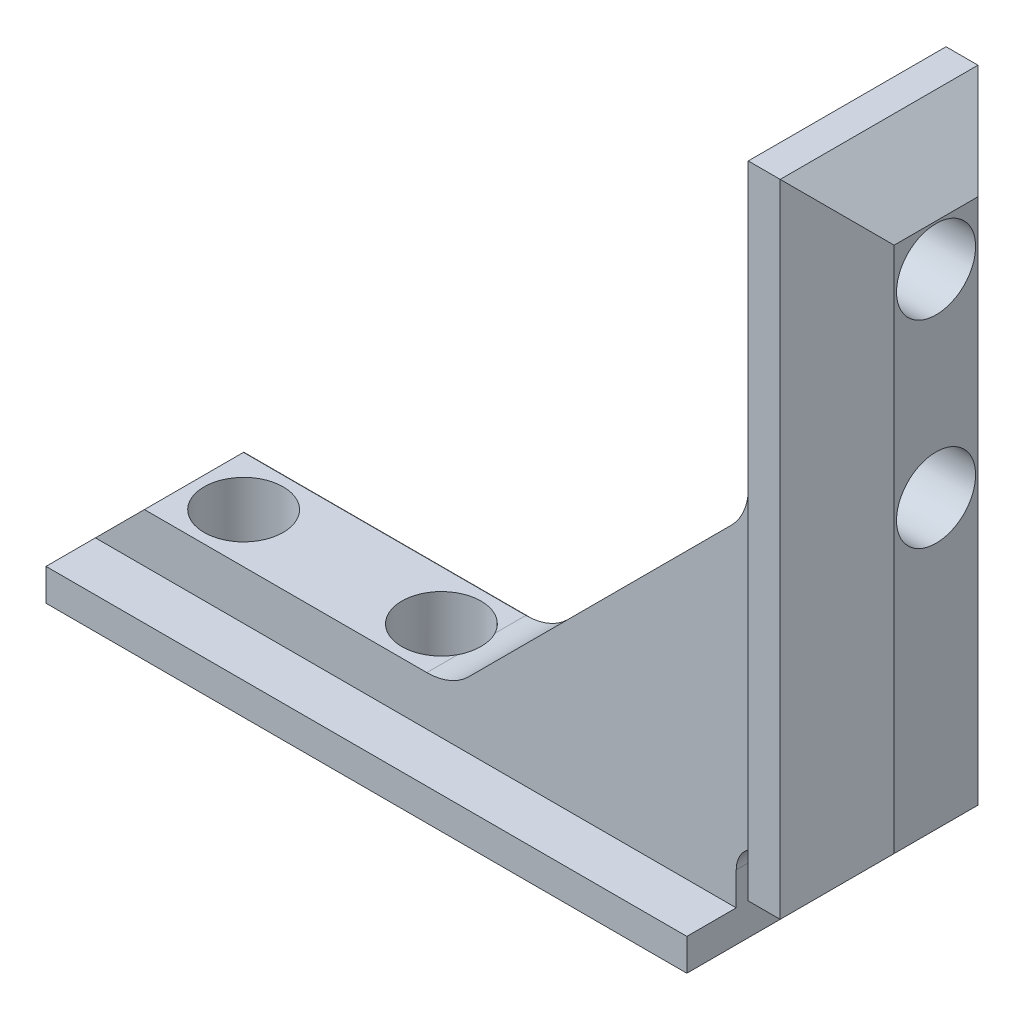
from build123d import *

# Parameters (mm, degrees)
EXTRUDE1_DEPTH          = 15.875
SKETCH2_W               = 56.3626
SKETCH2_H               = 56.3626
CUT_EXTRUDE1_DEPTH      = 3.9624
SKETCH3_W               = 56.3626
SKETCH3_H               = 56.3626
CUT_EXTRUDE2_DEPTH      = 3.9624
CUT_EXTRUDE3_DEPTH      = 174.221342401
CUT_EXTRUDE4_DEPTH      = 138.612224622
SKETCH7_R               = 3.175
CUT_EXTRUDE6_DEPTH      = 174.221342401
CUT_EXTRUDE7_DEPTH      = 3.9624
CUT_EXTRUDE7_DEPTH_BACK = 133.865789145
SKETCH9_R               = 3.175


with BuildPart() as part:
    # Sketch1 → Extrude1 (new body)
    with BuildSketch(Plane.XY):
        with BuildLine():
            Line((108.579689187, 130.408922074), (87.518897096, 109.348129983))
            ThreePointArc((87.518897096, 109.348129983), (85.973830897, 108.315749755), (84.15130105, 107.953226029))
            Line((84.15130105, 107.953226029), (61.485993141, 107.953226029))
            Line((61.485993141, 107.953226029), (57.548993141, 104.016226029))
            Line((57.548993141, 104.016226029), (57.548993141, 101.450826029))
            Line((57.548993141, 101.450826029), (62.120993141, 96.878826029))
            Line((62.120993141, 96.878826029), (104.411993141, 96.878826029))
            Line((104.411993141, 96.878826029), (108.983993141, 101.450826029))
            Line((108.983993141, 101.450826029), (108.983993141, 106.657826029))
            ThreePointArc((108.983993141, 106.657826029), (109.653547039, 108.27427213), (111.269993141, 108.943826029))
            Line((111.269993141, 108.943826029), (116.476993141, 108.943826029))
            Line((116.476993141, 108.943826029), (121.048993141, 113.515826029))
            Line((121.048993141, 113.515826029), (121.048993141, 155.806826029))
            Line((121.048993141, 155.806826029), (116.476993141, 160.378826029))
            Line((116.476993141, 160.378826029), (113.911593141, 160.378826029))
            Line((113.911593141, 160.378826029), (109.974593141, 156.441826029))
            Line((109.974593141, 156.441826029), (109.974593141, 133.776518119))
            ThreePointArc((109.974593141, 133.776518119), (109.612069415, 131.953988273), (108.579689187, 130.408922074))
        make_face()
    extrude(amount=EXTRUDE1_DEPTH)

    # Sketch2 → Cut-Extrude1 (cut)
    with BuildSketch(Plane.XY.offset(15.875)):
        with Locations((85.730293141, 132.197526029)):
            Rectangle(SKETCH2_W, SKETCH2_H)
    extrude(amount=-CUT_EXTRUDE1_DEPTH, mode=Mode.SUBTRACT)

    # Sketch3 → Cut-Extrude2 (cut)
    with BuildSketch(Plane(origin=(0, 0, 0), x_dir=(-1, 0, 0), z_dir=(0, 0, -1))):
        with Locations((-85.730293141, 132.197526029)):
            Rectangle(SKETCH3_W, SKETCH3_H)
    extrude(amount=-CUT_EXTRUDE2_DEPTH, mode=Mode.SUBTRACT)

    # Sketch4 → Cut-Extrude3 (cut, through all)
    with BuildSketch(Plane.ZY.offset(-57.548993141)):
        Polygon((0, 101.450826029), (4.572, 96.878826029), (11.303, 96.878826029), (15.875, 101.450826029), (19.712057388, 96.14079716), (9.313004955, 92.313845979), (-3.516713195, 97.866362975), align=None)
    extrude(amount=-CUT_EXTRUDE3_DEPTH, mode=Mode.SUBTRACT)

    # Sketch6 → Cut-Extrude4 (cut, through all)
    with BuildSketch(Plane(origin=(0, 160.378826029, 0), x_dir=(1, 0, 0), z_dir=(0, 1, 0))):
        Polygon((116.476993141, -15.875), (121.048993141, -11.303), (121.048993141, -4.572), (116.476993141, 0), (122.85176925, 1.025817626), (123.595758284, -16.192214298), (117.254137473, -18.459609448), align=None)
    extrude(amount=-CUT_EXTRUDE4_DEPTH, mode=Mode.SUBTRACT)

    # Sketch7 → Cut-Extrude6 (cut, through all)
    with BuildSketch(Plane.ZY.offset(-57.548993141)):
        with Locations((7.9375, 136.579026029)):
            Circle(SKETCH7_R)
        with Locations((7.9375, 152.454026029)):
            Circle(SKETCH7_R)
    extrude(amount=-CUT_EXTRUDE6_DEPTH, mode=Mode.SUBTRACT)

    # Sketch9 → Cut-Extrude7 (cut, two sides: drawn at the far end of the back side and taken through both)
    with BuildSketch(Plane(origin=(0, 107.953226029, 0), x_dir=(1, 0, 0), z_dir=(0, 1, 0)).offset(-CUT_EXTRUDE7_DEPTH_BACK)):
        with Locations(Location((65.473793141, -7.9375, 0), (0, 0, 90))):
            Circle(SKETCH9_R)
        with Locations(Location((81.348793141, -7.9375, 0), (0, 0, 28.032682271))):
            Circle(SKETCH9_R)
    extrude(amount=CUT_EXTRUDE7_DEPTH + CUT_EXTRUDE7_DEPTH_BACK, mode=Mode.SUBTRACT)


solid = part.part
